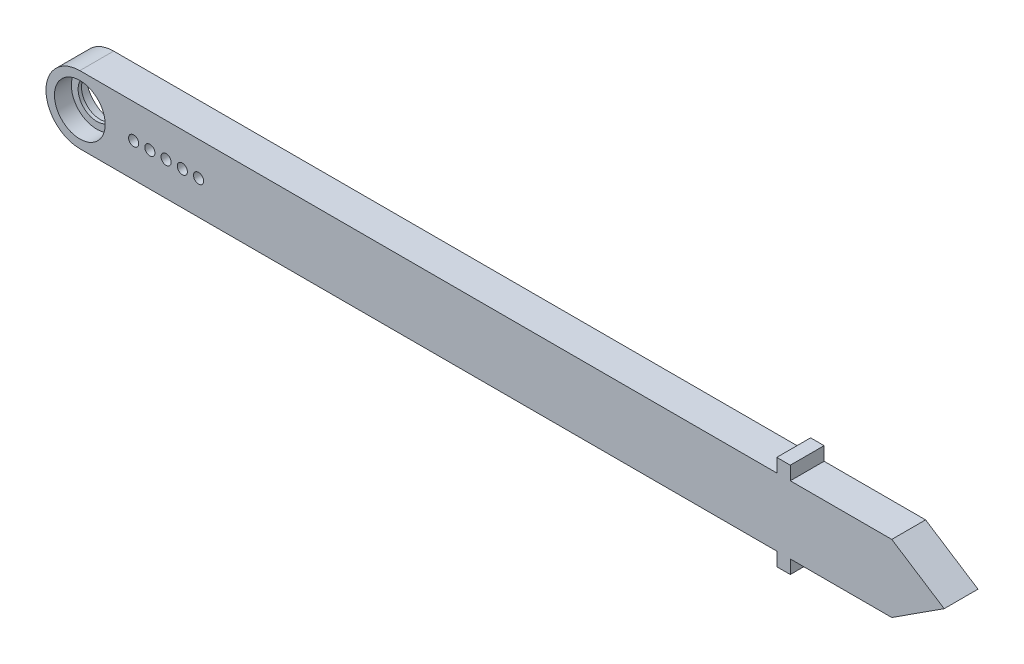
from build123d import *

# Parameters (mm, degrees)
SKETCH1_R               = 3.75
BOSS_EXTRUDE1_DEPTH     = 5
CUT_EXTRUDE2_DEPTH      = 2
SKETCH4_R               = 3.75
SKETCH4_R_2             = 2.75
BOSS_EXTRUDE2_DEPTH     = 0.5
SKETCH5_W               = 2
SKETCH5_H               = 5
BOSS_EXTRUDE3_DEPTH     = 2
SKETCH5_2_W             = 2
SKETCH5_2_H             = 5
BOSS_EXTRUDE4_DEPTH     = 12
CUT_EXTRUDE3_DEPTH      = 121.241423811
CUT_EXTRUDE3_DEPTH_BACK = 121.241423811
SKETCH6_R               = 0.75
BOSS_EXTRUDE5_DEPTH     = 5


with BuildPart() as part:
    # Sketch1 → Boss-Extrude1 (new body)
    with BuildSketch(Plane.XY):
        with BuildLine():
            Line((120, 5), (120, -5))
            Line((120, -5), (0, -5))
            ThreePointArc((0, -5), (-5, 0), (0, 5))
            Line((0, 5), (120, 5))
        make_face()
        Circle(SKETCH1_R, mode=Mode.SUBTRACT)
    extrude(amount=BOSS_EXTRUDE1_DEPTH)

    # Sketch3 → Cut-Extrude2 (cut)
    with BuildSketch(Plane(origin=(0, 0, 0), x_dir=(-1, 0, 0), z_dir=(0, 0, -1))):
        with BuildLine():
            Line((-16.129718884, 2.749435925), (0, 4.1))
            ThreePointArc((0, 4.1), (4.1, 0), (0, -4.1))
            Line((0, -4.1), (-16.129718884, -2.749435925))
            ThreePointArc((-16.129718884, -2.749435925), (-18.4, 0), (-16.129718884, 2.749435925))
        make_face()
    extrude(amount=-CUT_EXTRUDE2_DEPTH, mode=Mode.SUBTRACT)

    # Sketch4 → Boss-Extrude2 (add)
    with BuildSketch(Plane(origin=(0, 0, 2), x_dir=(-1, 0, 0), z_dir=(0, 0, -1))):
        Circle(SKETCH4_R)
        Circle(SKETCH4_R_2, mode=Mode.SUBTRACT)
    extrude(amount=-BOSS_EXTRUDE2_DEPTH)

    # Sketch5 → Boss-Extrude3 (add)
    with BuildSketch(Plane(origin=(0, 5, 0), x_dir=(1, 0, 0), z_dir=(0, 1, 0))):
        with Locations((104, -2.5)):
            Rectangle(SKETCH5_W, SKETCH5_H)
    extrude(amount=BOSS_EXTRUDE3_DEPTH)

    # Sketch5<2> → Boss-Extrude4 (add)
    with BuildSketch(Plane(origin=(0, 5, 0), x_dir=(1, 0, 0), z_dir=(0, 1, 0))):
        with Locations((104, -2.5)):
            Rectangle(SKETCH5_2_W, SKETCH5_2_H)
    extrude(amount=-BOSS_EXTRUDE4_DEPTH)

    # Sketch6 → Cut-Extrude3 (cut, two sides: drawn at the far end of the back side and taken through both)
    with BuildSketch(Plane(origin=(0, 0, 2), x_dir=(-1, 0, 0), z_dir=(0, 0, -1)).offset(-CUT_EXTRUDE3_DEPTH_BACK)):
        with Locations((-17.55, 0)):
            Circle(SKETCH6_R)
        with BuildLine():
            ThreePointArc((-15.9, 0), (-15.15, -0.75), (-14.4, 0))
            Line((-14.4, 0), (-15.9, 0))
        make_face()
        with BuildLine():
            Line((-15.9, 0), (-14.4, 0))
            ThreePointArc((-14.4, 0), (-15.15, 0.75), (-15.9, 0))
        make_face()
        with BuildLine():
            ThreePointArc((-13.5, 0), (-12.75, -0.75), (-12, 0))
            Line((-12, 0), (-13.5, 0))
        make_face()
        with BuildLine():
            Line((-13.5, 0), (-12, 0))
            ThreePointArc((-12, 0), (-12.75, 0.75), (-13.5, 0))
        make_face()
        with BuildLine():
            ThreePointArc((-11.1, 0), (-10.35, -0.75), (-9.6, 0))
            Line((-9.6, 0), (-11.1, 0))
        make_face()
        with BuildLine():
            Line((-11.1, 0), (-9.6, 0))
            ThreePointArc((-9.6, 0), (-10.35, 0.75), (-11.1, 0))
        make_face()
        with BuildLine():
            ThreePointArc((-8.7, 0), (-7.95, -0.75), (-7.2, 0))
            Line((-7.2, 0), (-8.7, 0))
        make_face()
        with BuildLine():
            Line((-8.7, 0), (-7.2, 0))
            ThreePointArc((-7.2, 0), (-7.95, 0.75), (-8.7, 0))
        make_face()
    extrude(amount=CUT_EXTRUDE3_DEPTH + CUT_EXTRUDE3_DEPTH_BACK, mode=Mode.SUBTRACT)

    # Sketch7 → Boss-Extrude5 (add)
    with BuildSketch(Plane.XY.offset(5)):
        Polygon((120, 5), (127.743232655, 0), (120, -5), align=None)
    extrude(amount=-BOSS_EXTRUDE5_DEPTH)


solid = part.part
